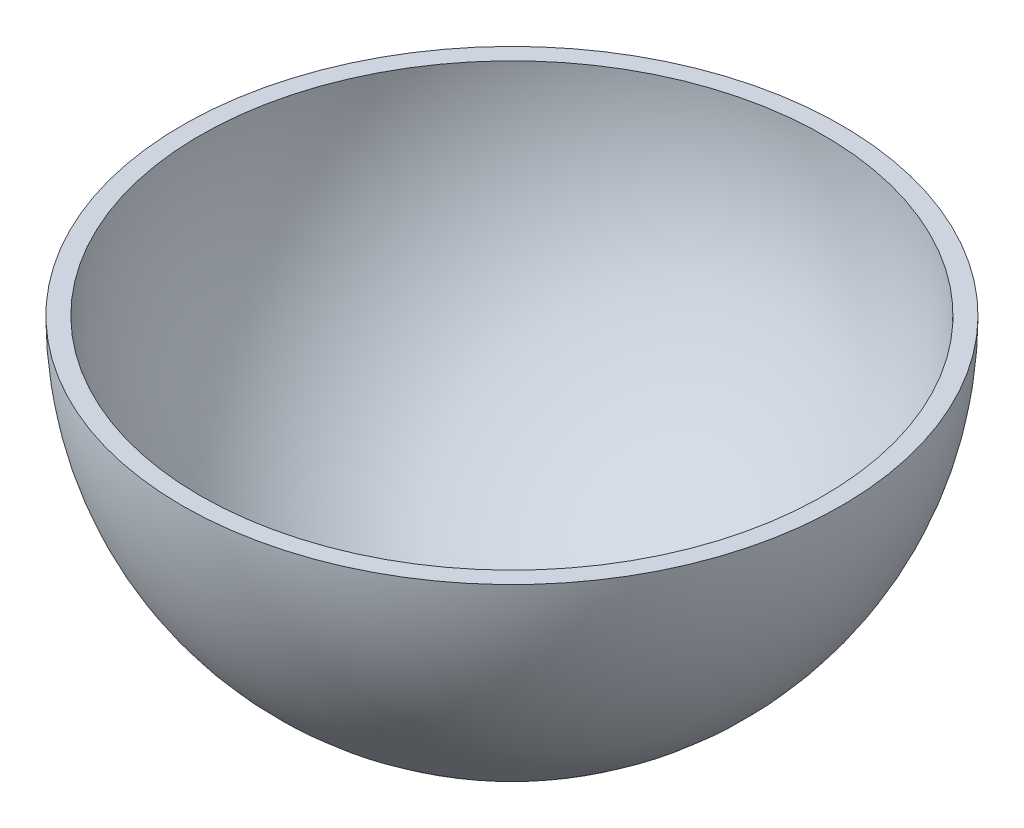
from build123d import *

# Parameters (mm, degrees)
CROQUIS2_W            = 10
CROQUIS2_H            = 14
REDONDEO1_R           = 1
CROQUIS3_R            = 29.845650159
CORTAR_EXTRUIR1_DEPTH = 30


with BuildPart() as part:
    # Croquis1 → Revolución3 (revolve)
    with BuildSketch(Plane(origin=(0, 0, 0), x_dir=(0, 0, -1), z_dir=(1, 0, 0))):
        with BuildLine():
            Line((-0.5, 27.995535358), (-0.5, 26.495282599))
            Line((-0.5, 26.495282599), (-0.5, 24.9949995))
            ThreePointArc((-0.5, 24.9949995), (-10.791516482, 22.5509018), (-19.151111078, 16.069690242))
            Line((-19.151111078, 16.069690242), (-20.300177743, 17.033871657))
            ThreePointArc((-20.300177743, 17.033871657), (-24.017156356, -11.199383936), (0, -26.5))
            Line((0, -26.5), (0, -28))
            ThreePointArc((0, -28), (-27.998883817, -0.250009966), (-0.5, 27.995535358))
        make_face()
    revolve(axis=Axis((0, 29, 0), (0, -1, 0)))

    # Croquis2 → Cortar-Revolución2 (revolve, cut)
    with BuildSketch(Plane(origin=(0, 0, 0), x_dir=(0, 0, -1), z_dir=(1, 0, 0))):
        with Locations((-5, 23)):
            Rectangle(CROQUIS2_W, CROQUIS2_H)
    revolve(axis=Axis((0, 0, 0), (0, 1, 0)), mode=Mode.SUBTRACT)

    # Redondeo1
    redondeo1_edges = [part.edges().sort_by_distance(p)[0] for p in [
        (0, 22.912878475, -10),
        (0, 26.153393661, -10),
        (0, 16.069690242, -19.151111078),
    ]]
    fillet(redondeo1_edges, radius=REDONDEO1_R)

    # Croquis3 → Cortar-Extruir1 (cut)
    with BuildSketch(Plane(origin=(0, 0, 0), x_dir=(1, 0, 0), z_dir=(0, 1, 0))):
        Circle(CROQUIS3_R)
    extrude(amount=CORTAR_EXTRUIR1_DEPTH, mode=Mode.SUBTRACT)


solid = part.part
